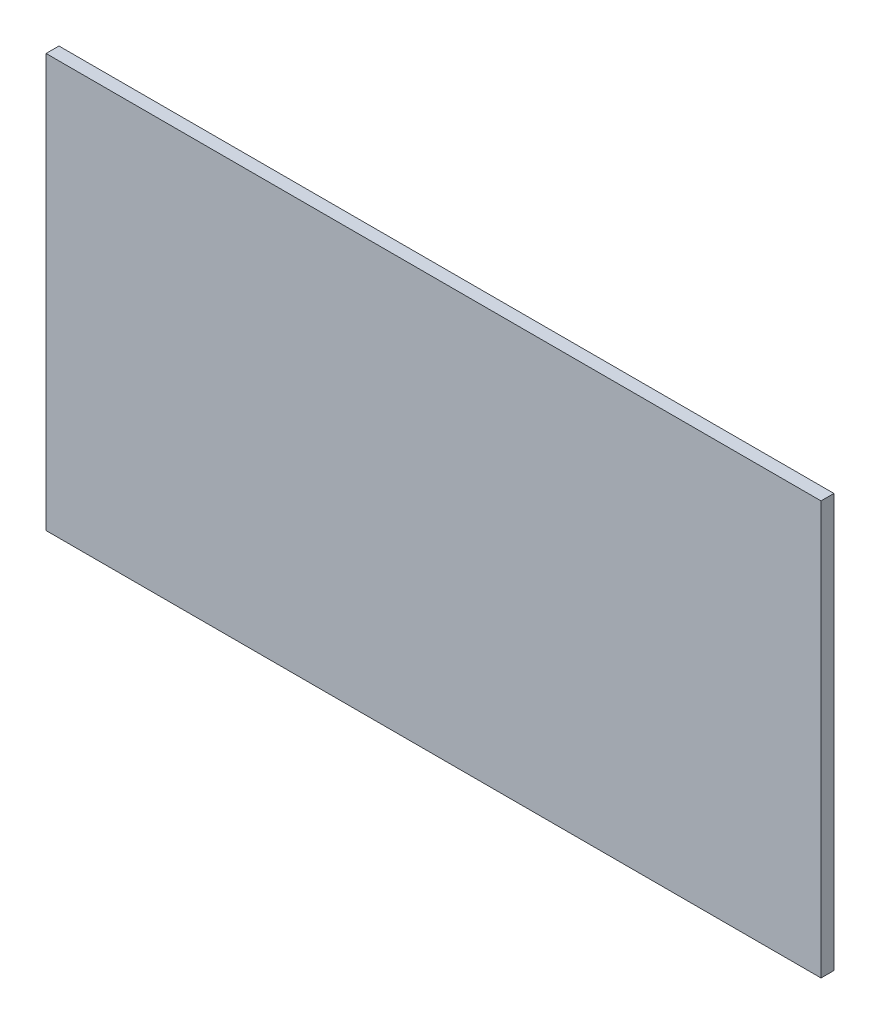
from build123d import *

# Parameters (mm, degrees)
SKETCH1_W           = 150.05
SKETCH1_H           = 80
BOSS_EXTRUDE1_DEPTH = 2.5
SKETCH2_W           = 30
SKETCH2_H           = 5
BOSS_EXTRUDE2_DEPTH = 5


with BuildPart() as part:
    # Sketch1 → Boss-Extrude1 (new body)
    with BuildSketch(Plane.XY):
        with Locations((75.025, 40)):
            Rectangle(SKETCH1_W, SKETCH1_H)
    extrude(amount=BOSS_EXTRUDE1_DEPTH)

    # Sketch2 → Boss-Extrude2 (add)
    with BuildSketch(Plane(origin=(0, 0, 0), x_dir=(-1, 0, 0), z_dir=(0, 0, -1))):
        with Locations((-75.025, 14.226547444)):
            Rectangle(SKETCH2_W, SKETCH2_H)
    extrude(amount=BOSS_EXTRUDE2_DEPTH)


solid = part.part
